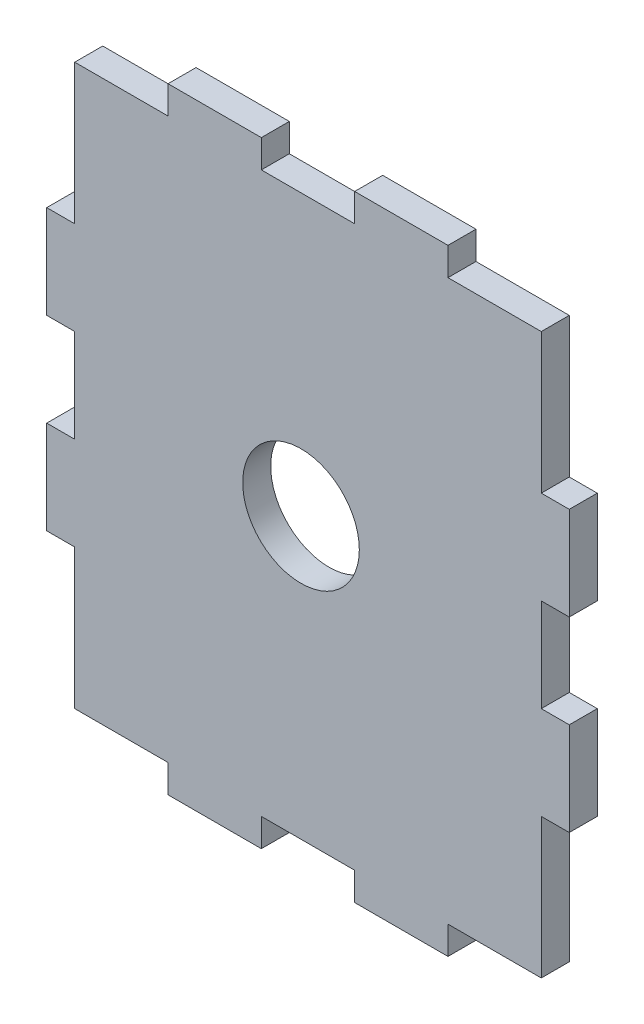
from build123d import *

# Parameters (mm, degrees)
ESBO_O2_R                = 12.5
RESSALTO_EXTRUS_O8_DEPTH = 6


with BuildPart() as part:
    # Esboço2 → Ressalto-extrusão8 (new body)
    with BuildSketch(Plane.XY):
        Polygon((-40, 0), (-20, 0), (-20, 6), (0, 6), (0, 0), (20, 0), (20, 6), (40, 6), (40, 0), (60, 0), (60, -30), (66, -30), (66, -50), (60, -50), (60, -70), (66, -70), (66, -90), (60, -90), (60, -120), (40, -120), (40, -126), (20, -126), (20, -120), (0, -120), (0, -126), (-20, -126), (-20, -120), (-40, -120), (-40, -90), (-46, -90), (-46, -70), (-40, -70), (-40, -50), (-46, -50), (-46, -30), (-40, -30), align=None)
        with Locations((8.5, -60)):
            Circle(ESBO_O2_R, mode=Mode.SUBTRACT)
    extrude(amount=RESSALTO_EXTRUS_O8_DEPTH)


solid = part.part
